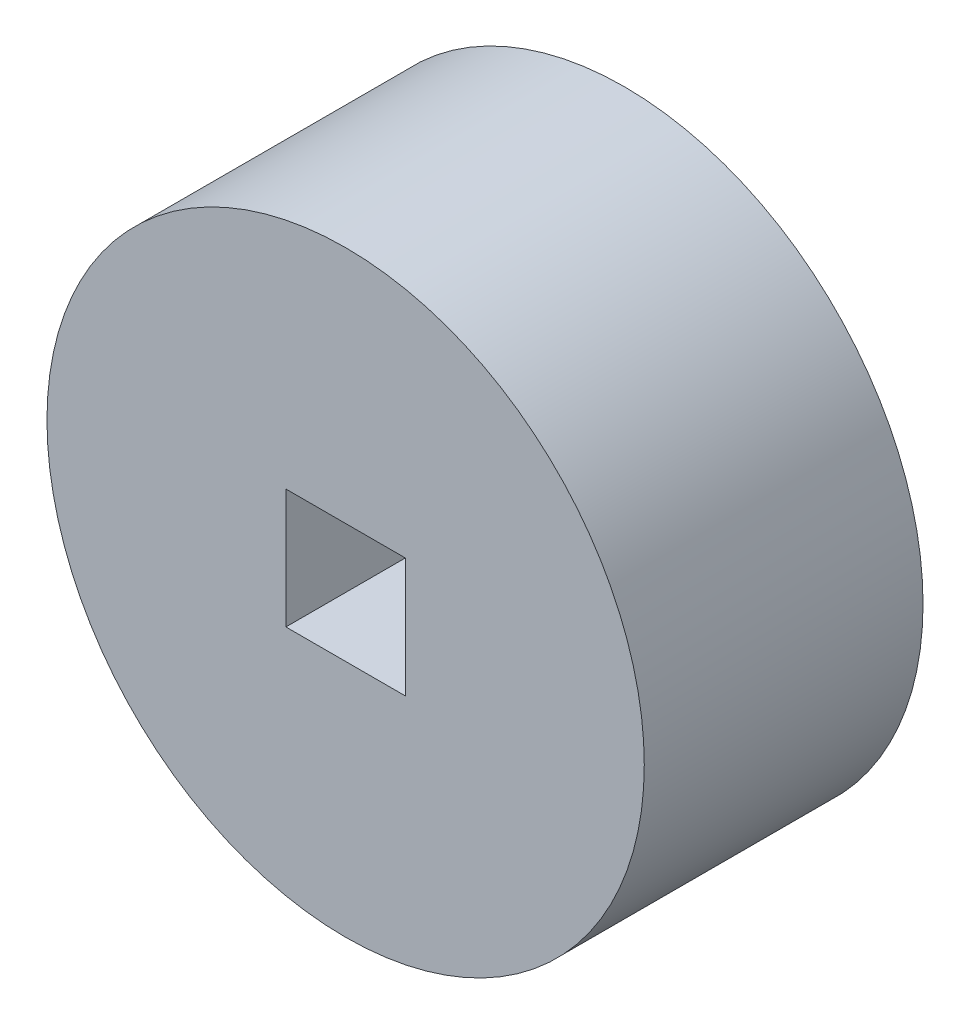
from build123d import *

# Parameters (mm, degrees)
SKETCH1_R           = 7.5
BOSS_EXTRUDE1_DEPTH = 7
SKETCH2_W           = 3
SKETCH2_H           = 3
CUT_EXTRUDE1_DEPTH  = 13.708265027


with BuildPart() as part:
    # Sketch1 → Boss-Extrude1 (new body)
    with BuildSketch(Plane.XY):
        Circle(SKETCH1_R)
    extrude(amount=BOSS_EXTRUDE1_DEPTH)

    # Sketch2 → Cut-Extrude1 (cut, through all)
    with BuildSketch(Plane(origin=(0, 0, 0), x_dir=(-1, 0, 0), z_dir=(0, 0, -1))):
        Rectangle(SKETCH2_W, SKETCH2_H)
    extrude(amount=-CUT_EXTRUDE1_DEPTH, mode=Mode.SUBTRACT)


solid = part.part
